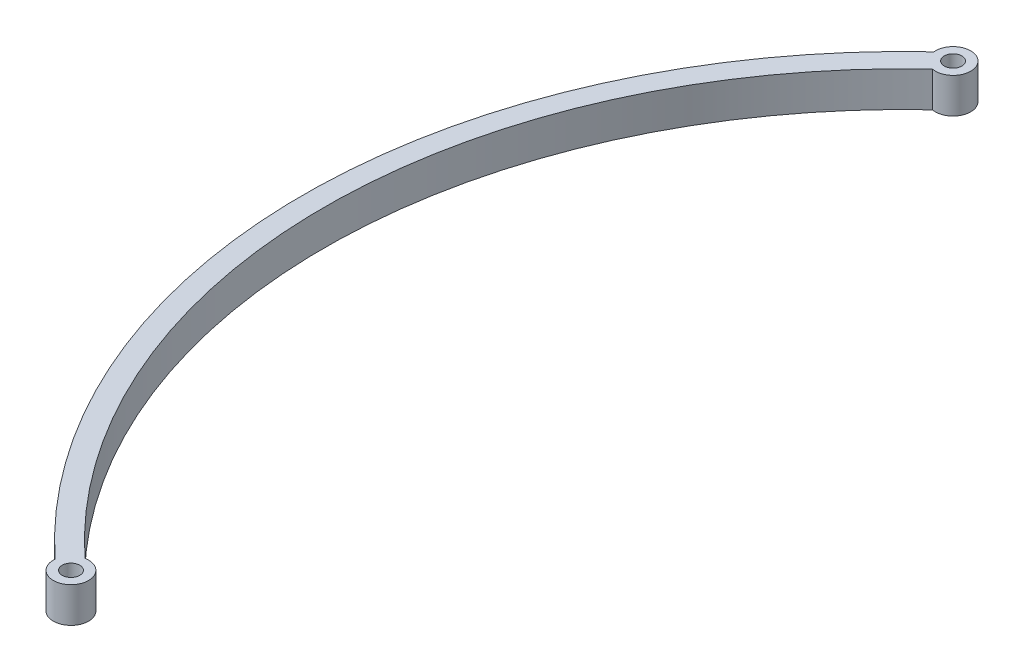
from build123d import *

# Parameters (mm, degrees)
BOSS_EXTRU_1_DEPTH      = 10
ESQUISSE2_R             = 2.5
ENL_V_MAT_EXTRU_1_DEPTH = 10


with BuildPart() as part:
    # Esquisse1 → Boss.-Extru.1 (new body)
    with BuildSketch(Plane(origin=(0, 0, 0), x_dir=(1, 0, 0), z_dir=(0, 1, 0))):
        with BuildLine():
            ThreePointArc((-0.943707896, 213.69893991), (3.70122741, 221.970757316), (-4.978017186, 218.140731151))
            ThreePointArc((-4.978017186, 218.140731151), (-59.227468872, 93.60907386), (-4.978017186, -30.92258343))
            ThreePointArc((-4.978017186, -30.92258343), (3.70122741, -34.752609595), (-0.943707895, -26.48079219))
            ThreePointArc((-0.943707895, -26.48079219), (-53.227468872, 93.60907386), (-0.943707896, 213.69893991))
        make_face()
    extrude(amount=BOSS_EXTRU_1_DEPTH)

    # Esquisse2 → Enlèv. mat.-Extru.1 (cut)
    with BuildSketch(Plane(origin=(0, 10, 0), x_dir=(1, 0, 0), z_dir=(0, 1, 0))):
        with Locations(Location((0, 218.60907386, 0), (0, 0, 270))):
            Circle(ESQUISSE2_R)
        with Locations(Location((0, -31.39092614, 0), (0, 0, 270))):
            Circle(ESQUISSE2_R)
    extrude(amount=-ENL_V_MAT_EXTRU_1_DEPTH, mode=Mode.SUBTRACT)


solid = part.part
